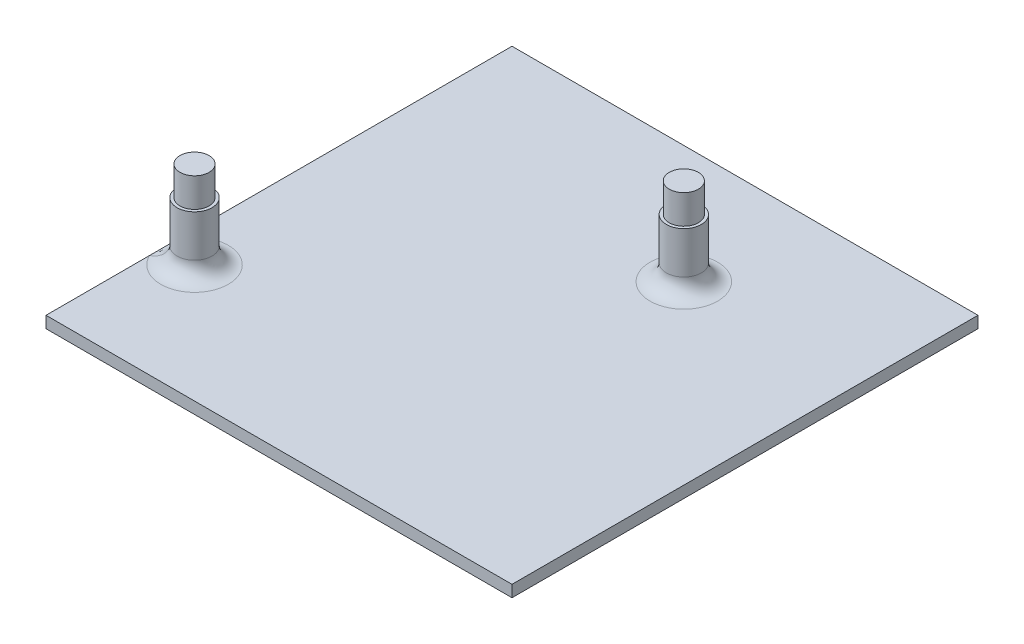
from build123d import *

# Parameters (mm, degrees)
SKETCH1_W           = 55
SKETCH1_H           = 55
BOSS_EXTRUDE1_DEPTH = 2
SKETCH2_R           = 3
BOSS_EXTRUDE2_DEPTH = 10
FILLET1_R           = 2.8
SKETCH3_R           = 2.5
BOSS_EXTRUDE3_DEPTH = 5


with BuildPart() as part:
    # Sketch1 → Boss-Extrude1 (new body)
    with BuildSketch(Plane(origin=(0, 0, 0), x_dir=(1, 0, 0), z_dir=(0, 1, 0))):
        Polygon((52.5, 40), (52.5, -40), (-27.5, -40), (-27.5, -27.5), (27.5, -27.5), (27.5, 27.5), (-27.5, 27.5), (-27.5, 40), align=None)
        Rectangle(SKETCH1_W, SKETCH1_H)
    extrude(amount=BOSS_EXTRUDE1_DEPTH)

    # Sketch2 → Boss-Extrude2 (add)
    with BuildSketch(Plane(origin=(0, 2, 0), x_dir=(1, 0, 0), z_dir=(0, 1, 0))):
        with Locations(Location((-22.25, -19.75, 0), (0, 0, 270))):
            Circle(SKETCH2_R)
        with Locations(Location((22.25, 19.75, 0), (0, 0, 270))):
            Circle(SKETCH2_R)
    extrude(amount=BOSS_EXTRUDE2_DEPTH)

    # Fillet1
    fillet1_edges = [part.edges().sort_by_distance(p)[0] for p in [
        (-22.25, 2, 16.75),
        (22.25, 2, -22.75),
    ]]
    fillet(fillet1_edges, radius=FILLET1_R)

    # Sketch3 → Boss-Extrude3 (add)
    with BuildSketch(Plane(origin=(0, 12, 0), x_dir=(1, 0, 0), z_dir=(0, 1, 0))):
        with Locations(Location((-22.25, -19.75, 0), (0, 0, 270))):
            Circle(SKETCH3_R)
        with Locations(Location((22.25, 19.75, 0), (0, 0, 270))):
            Circle(SKETCH3_R)
    extrude(amount=BOSS_EXTRUDE3_DEPTH)


solid = part.part
